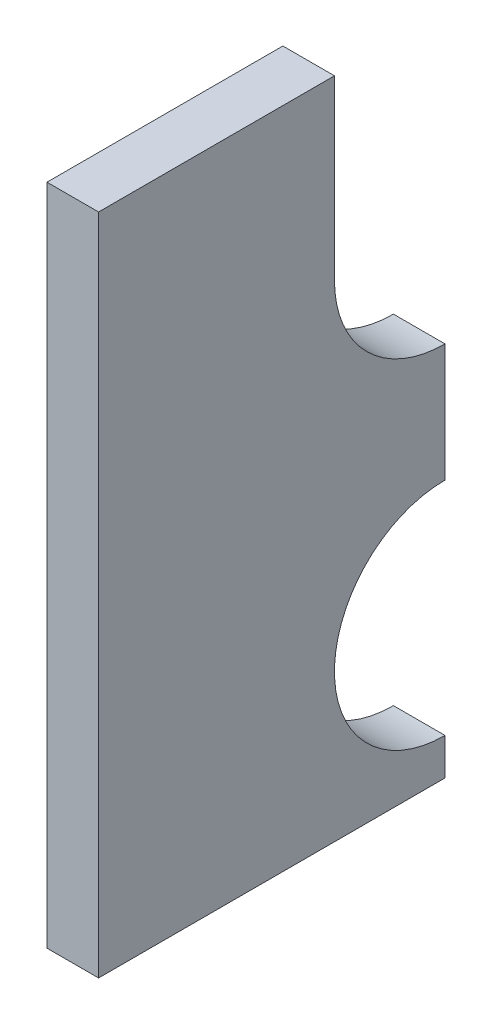
from build123d import *

# Parameters (mm, degrees)
SKETCH1_W           = 17.78
SKETCH1_H           = 228.6
BOSS_EXTRUDE1_DEPTH = 119.38
CUT_EXTRUDE1_DEPTH  = 259.506620418


with BuildPart() as part:
    # Sketch1 → Boss-Extrude1 (new body)
    with BuildSketch(Plane.XY):
        with Locations((8.89, -114.3)):
            Rectangle(SKETCH1_W, SKETCH1_H)
    extrude(amount=BOSS_EXTRUDE1_DEPTH)

    # Sketch2 → Cut-Extrude1 (cut, through all)
    with BuildSketch(Plane(origin=(17.78, 0, 0), x_dir=(0, 0, -1), z_dir=(1, 0, 0))):
        with BuildLine():
            Line((-38.1, -60.96), (-38.1, 0))
            Line((-38.1, 0), (0, 0))
            Line((0, 0), (0, -22.86))
            Line((0, -22.86), (0, -99.06))
            ThreePointArc((0, -99.06), (-26.940768363, -87.900768363), (-38.1, -60.96))
        make_face()
        with BuildLine():
            Line((0, -215.9), (0, -139.7))
            ThreePointArc((0, -139.7), (-38.1, -177.8), (0, -215.9))
        make_face()
    extrude(amount=-CUT_EXTRUDE1_DEPTH, mode=Mode.SUBTRACT)


solid = part.part
